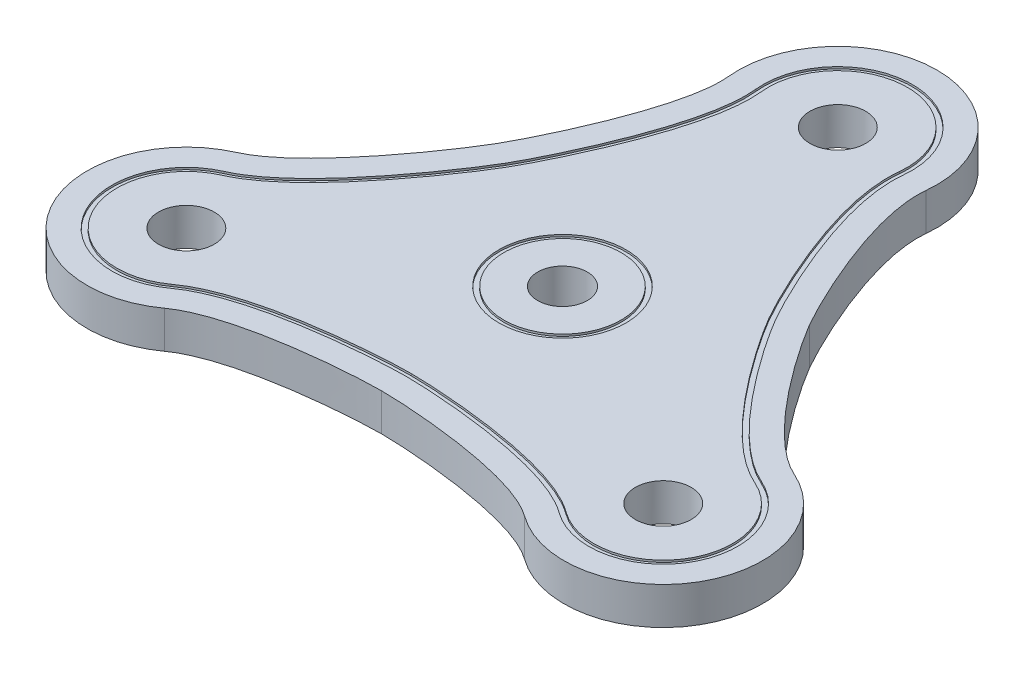
from build123d import *
from build123d.topology import SkipClean

# Parameters (mm, degrees)
SKETCH1_R                   = 3.175
BOSS_EXTRUDE1_DEPTH         = 4.7752
FILLET1_R                   = 12.7
F_1_4_CLEARANCE_HOLE1_D     = 7.14248
F_1_4_CLEARANCE_HOLE1_DEPTH = 35.052
F_1_4_CLEARANCE_HOLE1_TIP   = 2.145817477
CUT_EXTRUDE3_DEPTH          = 65.697828004
CIRPATTERN6_COUNT           = 3
SKETCH9_R                   = 8.127206718
SKETCH9_R_2                 = 7.492206718
CUT_EXTRUDE4_DEPTH          = 0.254


with BuildPart() as part:
    # Sketch1 → Boss-Extrude1 (new body)
    with BuildSketch(Plane(origin=(0, 0, 0), x_dir=(1, 0, 0), z_dir=(0, 1, 0))):
        Polygon((52.500072473, -30.310930975), (-52.500072473, -30.310930975), (0, 60.621861949), align=None)
        Circle(SKETCH1_R, mode=Mode.SUBTRACT)
    extrude(amount=BOSS_EXTRUDE1_DEPTH)

    # Fillet1
    fillet1_edges = [part.edges().sort_by_distance(p)[0] for p in [
        (52.500072473, 2.3876, 30.310930975),
        (0, 2.3876, -60.621861949),
        (-52.500072473, 2.3876, 30.310930975),
    ]]
    fillet(fillet1_edges, radius=FILLET1_R)

    # 1/4 Clearance Hole1
    with Locations(Plane(origin=(0, 4.7752, 0), x_dir=(1, 0, 0), z_dir=(0, 1, 0))):
        with Locations((0, 35.221861949), (-30.503027217, -17.610930975), (30.503027217, -17.610930975)):
            Hole(F_1_4_CLEARANCE_HOLE1_D / 2, depth=F_1_4_CLEARANCE_HOLE1_DEPTH)
            with Locations((0, 0, -(F_1_4_CLEARANCE_HOLE1_DEPTH + F_1_4_CLEARANCE_HOLE1_TIP / 2))):  # 118° drill point
                Cone(0, F_1_4_CLEARANCE_HOLE1_D / 2, F_1_4_CLEARANCE_HOLE1_TIP, mode=Mode.SUBTRACT)

    # Sketch8 → Cut-Extrude3 (cut, through all)
    with SkipClean():  # the faces are left unmerged after this step: merging them gives an invalid solid
        with BuildSketch(Plane(origin=(0, 0, 0), x_dir=(1, 0, 0), z_dir=(0, 1, 0))):
            with BuildLine():
                Line((41.501549845, -11.260930975), (10.998522628, 41.571861949))
                ThreePointArc((10.998522628, 41.571861949), (12.423493307, 37.857542897), (12.629398983, 33.884595589))
                add(Edge.make_bspline(
                    [(12.629398983, 33.884595589), (11.958108984, 27.544804592), (18.056712722, 15.017510096), (22.033901606, 8.128816878), (29.833555011, -3.416376135), (35.659620068, -6.00491744)],
                    knots=[0, 0, 0, 0, 1, 1, 2, 2, 2, 2], degree=3))
                ThreePointArc((35.659620068, -6.00491744), (38.997340527, -8.169710641), (41.501549845, -11.260930975))
            make_face()
        cut_extrude3 = extrude(amount=CUT_EXTRUDE3_DEPTH, mode=Mode.SUBTRACT)

    # CirPattern6: Cut-Extrude3 ×3 about axis
    with SkipClean():  # the faces are left unmerged after this step: merging them gives an invalid solid
        cirpattern6_axis = Axis((0, 12.91778813, 0), (0, -1, 0))
        for i in range(1, CIRPATTERN6_COUNT):
            add(cut_extrude3.rotate(cirpattern6_axis, i * 360 / CIRPATTERN6_COUNT), mode=Mode.SUBTRACT)

    # Sketch9 → Cut-Extrude4 (cut)
    # profile 1 of 2: a face of its own
    with SkipClean():  # the faces are left unmerged after this step: merging them gives an invalid solid
        with BuildSketch(Plane(origin=(0, 4.7752, 0), x_dir=(1, 0, 0), z_dir=(0, 1, 0))):
            with BuildLine():
                add(Edge.make_bspline(
                    [(34.370471855, -8.906420824), (33.35807902, -8.456611107), (31.491172071, -7.293894643), (28.837615716, -5.01555071), (26.298241575, -2.369182232), (23.903765925, 0.471795732), (21.720344369, 3.324913877), (20.140549683, 5.556415162), (19.061102312, 7.159908695), (18.352807549, 8.250313978), (17.856640937, 9.044200376), (17.514387433, 9.611160948), (17.36986578, 9.857163897), (17.221487234, 10.114163077), (17.080703258, 10.362323974), (16.760827751, 10.94220449), (16.321385269, 11.76884058), (15.731213975, 12.927444479), (14.882271526, 14.664020091), (13.739632068, 17.147913064), (12.360470052, 20.465370671), (11.097348788, 23.959536395), (10.075213529, 27.48188315), (9.428887982, 30.91910233), (9.355399461, 33.117249406), (9.472049238, 34.218912179)],
                    knots=[0, 0, 0, 0, 0.125, 0.25, 0.375, 0.5, 0.625, 0.75, 0.8125, 0.875, 0.9375, 0.96875, 1, 1, 1.03125, 1.0625, 1.125, 1.1875, 1.25, 1.375, 1.5, 1.625, 1.75, 1.875, 2, 2, 2, 2], degree=3))
                ThreePointArc((9.472049238, 34.218912179), (0, 44.746861949), (-9.472049238, 34.218912179))
                add(Edge.make_bspline(
                    [(-9.472049238, 34.218912179), (-9.355399461, 33.117249406), (-9.428887982, 30.91910233), (-10.075213529, 27.48188315), (-11.097348788, 23.959536395), (-12.360470052, 20.465370671), (-13.739632068, 17.147913064), (-14.882271526, 14.664020091), (-15.731213975, 12.927444479), (-16.321385269, 11.76884058), (-16.760827751, 10.94220449), (-17.080703258, 10.362323974), (-17.221487234, 10.114163077), (-17.36986578, 9.857163897), (-17.514387433, 9.611160948), (-17.856640937, 9.044200376), (-18.352807549, 8.250313978), (-19.061102312, 7.159908695), (-20.140549683, 5.556415162), (-21.720344369, 3.324913877), (-23.903765925, 0.471795732), (-26.298241575, -2.369182232), (-28.837615716, -5.01555071), (-31.491172071, -7.293894643), (-33.35807902, -8.456611107), (-34.370471855, -8.906420824)],
                    knots=[0, 0, 0, 0, 0.125, 0.25, 0.375, 0.5, 0.625, 0.75, 0.8125, 0.875, 0.9375, 0.96875, 1, 1, 1.03125, 1.0625, 1.125, 1.1875, 1.25, 1.375, 1.5, 1.625, 1.75, 1.875, 2, 2, 2, 2], degree=3))
                ThreePointArc((-34.370471855, -8.906420824), (-38.751919188, -22.373430975), (-24.898422618, -25.312491355))
                add(Edge.make_bspline(
                    [(-24.898422618, -25.312491355), (-24.002679559, -24.660638299), (-22.062284089, -23.625207687), (-18.762402187, -22.46633244), (-15.200892787, -21.590354163), (-11.543295873, -20.937166403), (-7.980712302, -20.472826941), (-5.258278158, -20.220435253), (-3.329888337, -20.087353174), (-2.031422281, -20.019154557), (-1.095813186, -19.986404866), (-0.433684175, -19.973484923), (-0.148378546, -19.971326974), (0.148378546, -19.971326974), (0.433684175, -19.973484923), (1.095813186, -19.986404866), (2.031422281, -20.019154557), (3.329888337, -20.087353174), (5.258278158, -20.220435253), (7.980712302, -20.472826941), (11.543295873, -20.937166403), (15.200892787, -21.590354163), (18.762402187, -22.46633244), (22.062284089, -23.625207687), (24.002679559, -24.660638299), (24.898422618, -25.312491355)],
                    knots=[0, 0, 0, 0, 0.125, 0.25, 0.375, 0.5, 0.625, 0.75, 0.8125, 0.875, 0.9375, 0.96875, 1, 1, 1.03125, 1.0625, 1.125, 1.1875, 1.25, 1.375, 1.5, 1.625, 1.75, 1.875, 2, 2, 2, 2], degree=3))
                ThreePointArc((24.898422618, -25.312491355), (38.751919188, -22.373430975), (34.370471855, -8.906420824))
            make_face()
            with BuildLine():
                ThreePointArc((-8.840579288, 34.285775497), (0, 44.111861949), (8.840579288, 34.285775497))
                add(Edge.make_bspline(
                    [(8.840579288, 34.285775497), (8.719117683, 33.138668887), (8.796015096, 30.832551398), (9.458070398, 27.331253467), (10.493866686, 23.76000484), (11.768755216, 20.234499988), (13.157870034, 16.89300831), (14.307940154, 14.393010433), (15.162868833, 12.644170244), (15.757794281, 11.476213176), (16.201888007, 10.64080226), (16.526244391, 10.052770823), (16.670102188, 9.799189992), (16.821398563, 9.537136982), (16.969077106, 9.28576206), (17.316149077, 8.710845473), (17.817589291, 7.908543567), (18.531607058, 6.809344482), (19.618682749, 5.194534433), (21.20870936, 2.948545554), (23.407968631, 0.074790994), (25.823701129, -2.792047286), (28.398595018, -5.474697498), (31.099780322, -7.798703173), (33.058487945, -9.018357032), (34.112642213, -9.4867215)],
                    knots=[0, 0, 0, 0, 0.125, 0.25, 0.375, 0.5, 0.625, 0.75, 0.8125, 0.875, 0.9375, 0.96875, 1, 1, 1.03125, 1.0625, 1.125, 1.1875, 1.25, 1.375, 1.5, 1.625, 1.75, 1.875, 2, 2, 2, 2], degree=3))
                ThreePointArc((34.112642213, -9.4867215), (38.201993056, -22.055930975), (25.272062924, -24.799053996))
                add(Edge.make_bspline(
                    [(25.272062924, -24.799053996), (24.339370263, -24.120311855), (22.303765226, -23.033848224), (18.94052462, -21.856555969), (15.329834442, -20.967957554), (11.639213414, -20.309290982), (8.050839326, -19.841553864), (5.310742595, -19.587544865), (3.368738225, -19.453514726), (2.05979501, -19.384756743), (1.11426107, -19.351647733), (0.442832716, -19.338532883), (0.151296375, -19.336326974), (-0.151296375, -19.336326974), (-0.442832716, -19.338532883), (-1.11426107, -19.351647733), (-2.05979501, -19.384756743), (-3.368738225, -19.453514726), (-5.310742595, -19.587544865), (-8.050839326, -19.841553864), (-11.639213414, -20.309290982), (-15.329834442, -20.967957554), (-18.94052462, -21.856555969), (-22.303765226, -23.033848224), (-24.339370263, -24.120311855), (-25.272062924, -24.799053996)],
                    knots=[0, 0, 0, 0, 0.125, 0.25, 0.375, 0.5, 0.625, 0.75, 0.8125, 0.875, 0.9375, 0.96875, 1, 1, 1.03125, 1.0625, 1.125, 1.1875, 1.25, 1.375, 1.5, 1.625, 1.75, 1.875, 2, 2, 2, 2], degree=3))
                ThreePointArc((-25.272062924, -24.799053996), (-38.201993056, -22.055930975), (-34.112642213, -9.4867215))
                add(Edge.make_bspline(
                    [(-34.112642213, -9.4867215), (-33.058487945, -9.018357032), (-31.099780322, -7.798703173), (-28.398595018, -5.474697498), (-25.823701129, -2.792047286), (-23.407968631, 0.074790994), (-21.20870936, 2.948545554), (-19.618682749, 5.194534433), (-18.531607058, 6.809344482), (-17.817589291, 7.908543567), (-17.316149077, 8.710845473), (-16.969077106, 9.28576206), (-16.821398563, 9.537136982), (-16.670102188, 9.799189992), (-16.526244391, 10.052770823), (-16.201888007, 10.64080226), (-15.757794281, 11.476213176), (-15.162868833, 12.644170244), (-14.307940154, 14.393010433), (-13.157870034, 16.89300831), (-11.768755216, 20.234499988), (-10.493866686, 23.76000484), (-9.458070398, 27.331253467), (-8.796015096, 30.832551398), (-8.719117683, 33.138668887), (-8.840579288, 34.285775497)],
                    knots=[0, 0, 0, 0, 0.125, 0.25, 0.375, 0.5, 0.625, 0.75, 0.8125, 0.875, 0.9375, 0.96875, 1, 1, 1.03125, 1.0625, 1.125, 1.1875, 1.25, 1.375, 1.5, 1.625, 1.75, 1.875, 2, 2, 2, 2], degree=3))
            make_face(mode=Mode.SUBTRACT)
        # profile 2 of 2: a face of its own
        with BuildSketch(Plane(origin=(0, 4.7752, 0), x_dir=(1, 0, 0), z_dir=(0, 1, 0))):
            Circle(SKETCH9_R)
            Circle(SKETCH9_R_2, mode=Mode.SUBTRACT)
        extrude(amount=-CUT_EXTRUDE4_DEPTH, mode=Mode.SUBTRACT)


solid = part.part
